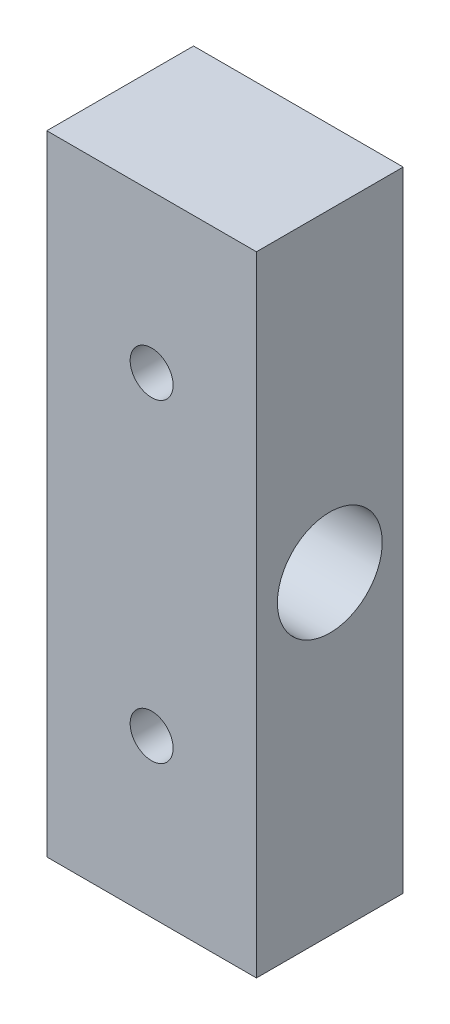
from build123d import *

# Parameters (mm, degrees)
SKETCH_1_W          = 20
SKETCH_1_H          = 14
EXTRUDE_1_DEPTH     = 60
CUT_EXTRUDE_1_REACH = 65.632
SKETCH_2_R          = 5
CUT_EXTRUDE_2_REACH = 64.418
SKETCH_3_R          = 2.05


with BuildPart() as part:
    # 草图1 → 凸台-拉伸1 (new body)
    with BuildSketch(Plane(origin=(0, 0, 0), x_dir=(1, 0, 0), z_dir=(0, 1, 0))):
        Rectangle(SKETCH_1_W, SKETCH_1_H)
    extrude(amount=EXTRUDE_1_DEPTH)

    # 草图2 → 切除-拉伸1 (cut, up to next)
    with BuildSketch(Plane.ZY.offset(10), mode=Mode.PRIVATE) as cut_extrude_1_sk1:
        with Locations((0, 30)):
            Circle(SKETCH_2_R)
    cut_extrude_1_tool1 = extrude(cut_extrude_1_sk1.sketch, amount=-CUT_EXTRUDE_1_REACH, mode=Mode.PRIVATE) & part.part
    add(cut_extrude_1_tool1.solids().sort_by_distance((-10, 30, 0))[0], mode=Mode.SUBTRACT)

    # 草图3 → 切除-拉伸2 (cut, up to next)
    with BuildSketch(Plane(origin=(0, 0, -7), x_dir=(-1, 0, 0), z_dir=(0, 0, -1)), mode=Mode.PRIVATE) as cut_extrude_2_sk1:
        with Locations((0, 45)):
            Circle(SKETCH_3_R)
    cut_extrude_2_tool1 = extrude(cut_extrude_2_sk1.sketch, amount=-CUT_EXTRUDE_2_REACH, mode=Mode.PRIVATE) & part.part
    # 草图3 → 切除-拉伸2 (cut, up to next)
    with BuildSketch(Plane(origin=(0, 0, -7), x_dir=(-1, 0, 0), z_dir=(0, 0, -1)), mode=Mode.PRIVATE) as cut_extrude_2_sk2:
        with Locations((0, 15)):
            Circle(SKETCH_3_R)
    cut_extrude_2_tool2 = extrude(cut_extrude_2_sk2.sketch, amount=-CUT_EXTRUDE_2_REACH, mode=Mode.PRIVATE) & part.part
    add(cut_extrude_2_tool1.solids().sort_by_distance((0, 45, -7))[0], mode=Mode.SUBTRACT)
    add(cut_extrude_2_tool2.solids().sort_by_distance((0, 15, -7))[0], mode=Mode.SUBTRACT)


solid = part.part
